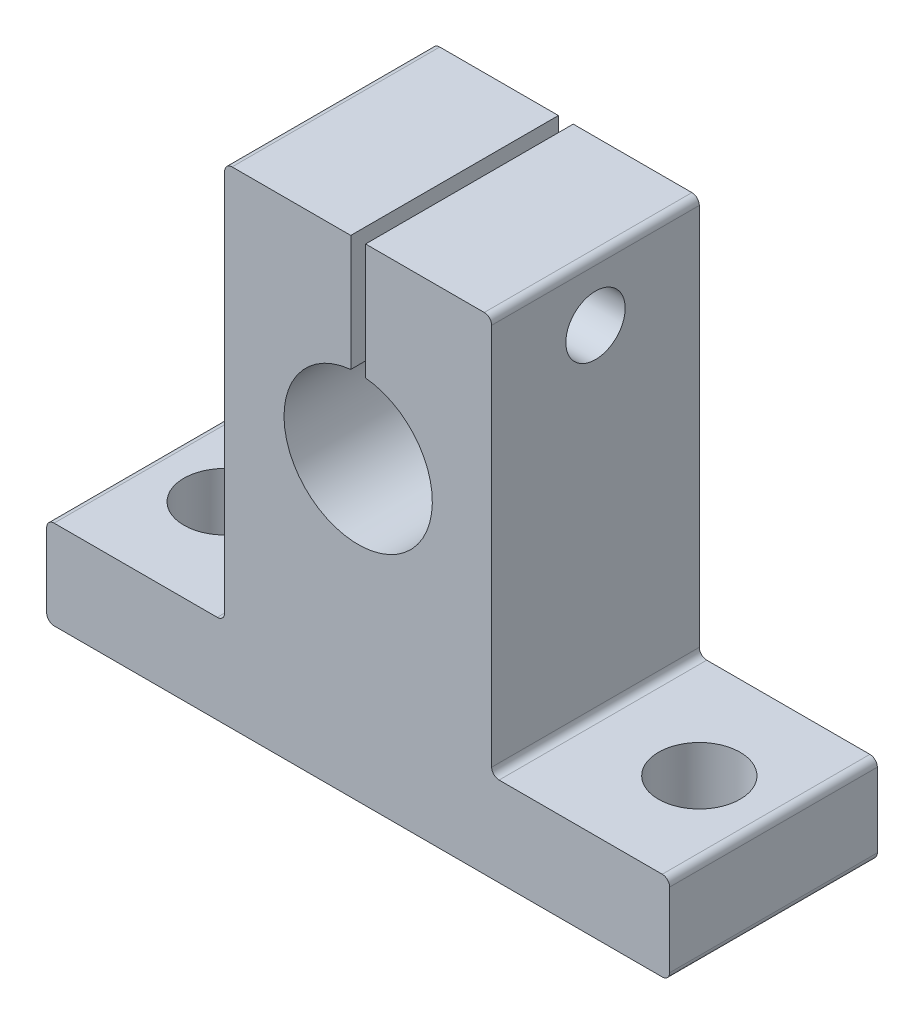
from build123d import *

# Parameters (mm, degrees)
BOSS_EXTRUDE1_DEPTH     = 7
SKETCH2_R               = 2.75
CUT_EXTRUDE1_DEPTH      = 30.433993953
CUT_EXTRUDE2_DEPTH      = 30.433993953
CUT_EXTRUDE2_DEPTH_BACK = 6
SKETCH3_R               = 2
FILLET1_R               = 0.5


with BuildPart() as part:
    # Sketch1 → Boss-Extrude1 (new, symmetric)
    with BuildSketch(Plane.XY):
        with BuildLine():
            Line((-9, -13.4), (-9, 13.4))
            Line((-9, 13.4), (-0.5, 13.4))
            Line((-0.5, 13.4), (-0.5, 5.574937186))
            ThreePointArc((-0.5, 5.574937186), (0, -4.4), (0.5, 5.574937186))
            Line((0.5, 5.574937186), (0.5, 13.4))
            Line((0.5, 13.4), (9, 13.4))
            Line((9, 13.4), (9, -13.4))
            Line((9, -13.4), (21, -13.4))
            Line((21, -13.4), (21, -19.4))
            Line((21, -19.4), (-21, -19.4))
            Line((-21, -19.4), (-21, -13.4))
            Line((-21, -13.4), (-9, -13.4))
        make_face()
    extrude(amount=BOSS_EXTRUDE1_DEPTH, both=True)

    # Sketch2 → Cut-Extrude1 (cut, through all)
    with BuildSketch(Plane(origin=(0, 0, 0), x_dir=(1, 0, 0), z_dir=(0, 1, 0))):
        with Locations(Location((-16, 0, 0), (0, 0, 270))):
            Circle(SKETCH2_R)
        with Locations((16, 0)):
            Circle(SKETCH2_R)
    extrude(amount=-CUT_EXTRUDE1_DEPTH, mode=Mode.SUBTRACT)

    # Sketch3 → Cut-Extrude2 (cut, two sides: drawn at the far end of the back side and taken through both)
    with BuildSketch(Plane(origin=(0, 0, 0), x_dir=(0, 0, -1), z_dir=(1, 0, 0)).offset(-CUT_EXTRUDE2_DEPTH_BACK)):
        with Locations(Location((0, 9.4, 0), (0, 0, 180))):
            Circle(SKETCH3_R)
    extrude(amount=CUT_EXTRUDE2_DEPTH + CUT_EXTRUDE2_DEPTH_BACK, mode=Mode.SUBTRACT)

    # Fillet1
    fillet1_edges = [part.edges().sort_by_distance(p)[0] for p in [
        (9, 13.4, 0),
        (9, -13.4, 0),
        (21, -13.4, 0),
        (21, -19.4, 0),
        (-21, -19.4, 0),
        (-21, -13.4, 0),
        (-9, -13.4, 0),
        (-9, 13.4, 0),
    ]]
    fillet(fillet1_edges, radius=FILLET1_R)


solid = part.part
